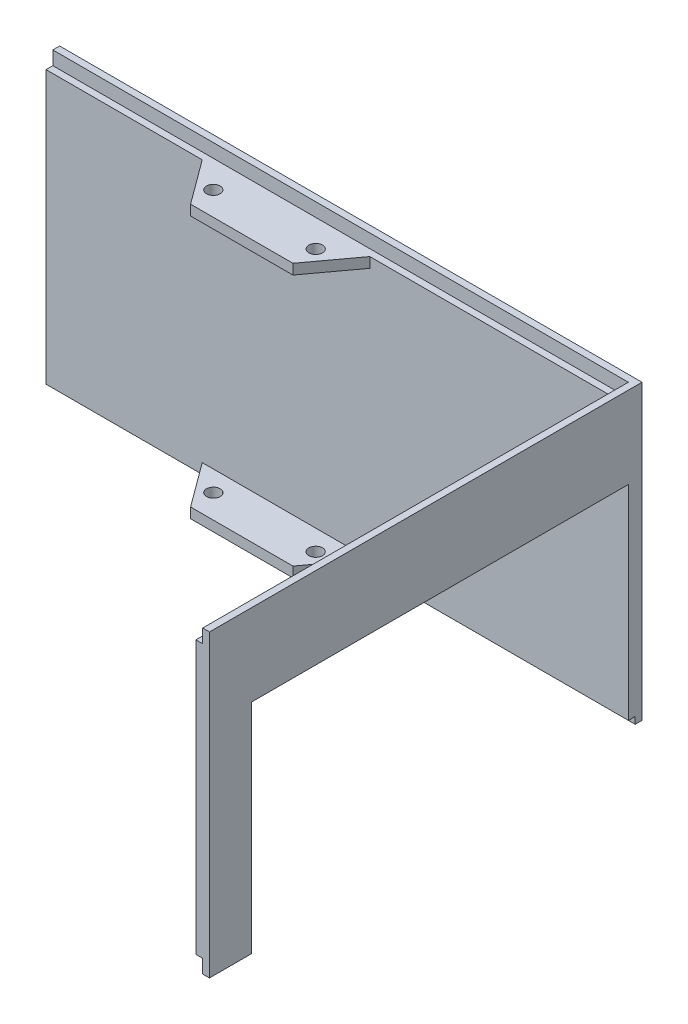
from build123d import *

# Parameters (mm, degrees)
CROQUIS1_W              = 171
CROQUIS1_H              = 80
SALIENTE_EXTRUIR1_DEPTH = 4
CROQUIS1_3_W            = 171
CROQUIS1_3_H            = 2
CROQUIS1_3_H_2          = 4
SALIENTE_EXTRUIR2_DEPTH = 2
SALIENTE_EXTRUIR3_DEPTH = 4
CROQUIS2_3_W            = 12.355999846
CROQUIS2_3_H            = 4
CROQUIS2_3_W_2          = 125
SALIENTE_EXTRUIR4_DEPTH = 2
SALIENTE_EXTRUIR5_DEPTH = 3
CROQUIS4_R              = 2
CORTAR_EXTRUIR1_DEPTH   = 3


with BuildPart() as part:
    # Croquis1 → Saliente-Extruir1 (new body)
    with BuildSketch(Plane.XY):
        with Locations((0, -1)):
            Rectangle(CROQUIS1_W, CROQUIS1_H)
    extrude(amount=SALIENTE_EXTRUIR1_DEPTH)

    # Croquis1<3> → Saliente-Extruir2 (add)
    with BuildSketch(Plane.XY):
        with Locations((0, -42)):
            Rectangle(CROQUIS1_3_W, CROQUIS1_3_H)
        with Locations((0, 41)):
            Rectangle(CROQUIS1_3_W, CROQUIS1_3_H_2)
    extrude(amount=SALIENTE_EXTRUIR2_DEPTH)

    # Croquis2 → Saliente-Extruir3 (add)
    with BuildSketch(Plane(origin=(85.5, 0, 0), x_dir=(0, 0, -1), z_dir=(1, 0, 0))):
        Polygon((-127, 19), (-127, -41), (-114.644000154, -41), (-114.644000154, 19), (-4, 19), (-4, 39), (-114.644000154, 39), (-127, 39), align=None)
    extrude(amount=-SALIENTE_EXTRUIR3_DEPTH)

    # Croquis2<3> → Saliente-Extruir4 (add)
    with BuildSketch(Plane(origin=(85.5, 0, 0), x_dir=(0, 0, -1), z_dir=(1, 0, 0))):
        with Locations((-120.822000077, -43)):
            Rectangle(CROQUIS2_3_W, CROQUIS2_3_H)
        with Locations((-64.5, 41)):
            Rectangle(CROQUIS2_3_W_2, CROQUIS2_3_H)
    extrude(amount=-SALIENTE_EXTRUIR4_DEPTH)

    # Croquis3 → Saliente-Extruir5 (add)
    with BuildSketch(Plane.XZ.offset(41)):
        Polygon((0, 17), (-30.05, 17), (-39.627423965, 4), (9.577423965, 4), align=None)
    saliente_extruir5 = extrude(amount=-SALIENTE_EXTRUIR5_DEPTH)

    # Croquis4 → Cortar-Extruir1 (cut)
    with BuildSketch(Plane(origin=(0, -38, 0), x_dir=(1, 0, 0), z_dir=(0, 1, 0))):
        with Locations((-0.3, -10.02)):
            Circle(CROQUIS4_R)
        with Locations((-30.35, -10.02)):
            Circle(CROQUIS4_R)
    cortar_extruir1 = extrude(amount=-CORTAR_EXTRUIR1_DEPTH, mode=Mode.SUBTRACT)

    # Simetría1: Saliente-Extruir5, Cortar-Extruir1 across plane
    add(saliente_extruir5.mirror(Plane(origin=(0, -1, 0), x_dir=(0, 0, 1), z_dir=(0, -1, 0))))
    add(cortar_extruir1.mirror(Plane(origin=(0, -1, 0), x_dir=(0, 0, 1), z_dir=(0, -1, 0))), mode=Mode.SUBTRACT)


solid = part.part
